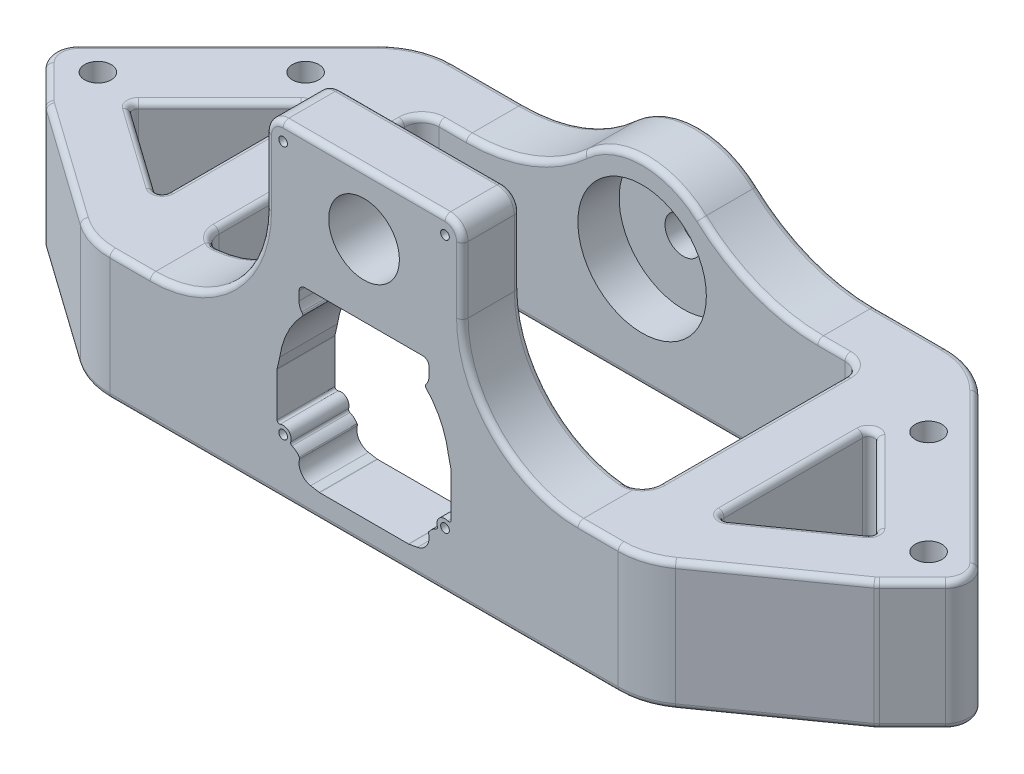
from build123d import *

# Parameters (mm, degrees)
SKETCH1_W           = 96.2
SKETCH1_H           = 58.1
SKETCH1_W_2         = 76.2
SKETCH1_H_2         = 38.1
SKETCH1_R           = 2.3
BOSS_EXTRUDE1_DEPTH = 22.25
BOSS_EXTRUDE2_START = 22.25
SKETCH1_3_W         = 96.2
SKETCH1_3_H         = 58.1
SKETCH1_3_W_2       = 76.2
SKETCH1_3_H_2       = 38.1
BOSS_EXTRUDE2_DEPTH = 15.85
SKETCH3_W           = 34
SKETCH3_H           = 18.6
SKETCH3_R           = 0.75
SKETCH3_R_2         = 6.113994518
BOSS_EXTRUDE3_DEPTH = 10
CUT_EXTRUDE1_REACH  = 116.403
SKETCH3_3_W         = 31.1
SKETCH3_3_H         = 15.85
CUT_EXTRUDE2_REACH  = 116.403
SKETCH3_4_R         = 0.75
CUT_EXTRUDE3_REACH  = 116.403
FILLET1_R           = 20
FILLET2_R           = 3
FILLET3_R           = 1
FILLET4_R           = 1
FILLET5_R           = 3
FILLET6_R           = 13
FILLET7_R           = 4
SKETCH5_R           = 11.1125
CUT_EXTRUDE4_DEPTH  = 7.1374
FILLET8_R           = 30
FILLET9_R           = 1


with BuildPart() as part:
    # Sketch1 → Boss-Extrude1 (new body)
    # profile 1 of 5: a face of its own
    with BuildSketch(Plane(origin=(0, 0, 0), x_dir=(1, 0, 0), z_dir=(0, 1, 0))):
        Rectangle(SKETCH1_W, SKETCH1_H)
        Rectangle(SKETCH1_W_2, SKETCH1_H_2, mode=Mode.SUBTRACT)
    # profile 2 of 5: a face of its own
    with BuildSketch(Plane(origin=(0, 0, 0), x_dir=(1, 0, 0), z_dir=(0, 1, 0))):
        Polygon((-80.606778943, -3.456778943), (-71.842048969, -12.221508917), (-64.669047511, -5.048507459), (-48.1, 11.520540052), (-48.1, 29.05), align=None)
        with Locations(Location((-71.842048969, -3.241252796, 0), (0, 0, 270))):
            Circle(SKETCH1_R, mode=Mode.SUBTRACT)
        with Locations(Location((-53.881536726, 14.719259446, 0), (0, 0, 270))):
            Circle(SKETCH1_R, mode=Mode.SUBTRACT)
    # profile 3 of 5: a face of its own
    with BuildSketch(Plane(origin=(0, 0, 0), x_dir=(1, 0, 0), z_dir=(0, 1, 0))):
        Polygon((64.669047511, -5.048507459), (71.842048969, -12.221508917), (80.606778943, -3.456778943), (48.1, 29.05), (48.1, 11.520540052), align=None)
        with Locations(Location((71.842048969, -3.241252796, 0), (0, 0, 270))):
            Circle(SKETCH1_R, mode=Mode.SUBTRACT)
        with Locations(Location((53.881536726, 14.719259446, 0), (0, 0, 270))):
            Circle(SKETCH1_R, mode=Mode.SUBTRACT)
    # profile 4 of 5: a face of its own
    with BuildSketch(Plane(origin=(0, 0, 0), x_dir=(1, 0, 0), z_dir=(0, 1, 0))):
        Polygon((-71.842048969, -12.221508917), (-48.1, -29.05), (-48.1, -16.792736808), (-64.669047511, -5.048507459), align=None)
    # profile 5 of 5: a face of its own
    with BuildSketch(Plane(origin=(0, 0, 0), x_dir=(1, 0, 0), z_dir=(0, 1, 0))):
        Polygon((48.1, -16.792736808), (48.1, -29.05), (71.842048969, -12.221508917), (64.669047511, -5.048507459), align=None)
    extrude(amount=BOSS_EXTRUDE1_DEPTH)

    # Sketch1<3> → Boss-Extrude2 (add)
    with BuildSketch(Plane(origin=(0, 0, 0), x_dir=(1, 0, 0), z_dir=(0, 1, 0)).offset(BOSS_EXTRUDE2_START)):
        Rectangle(SKETCH1_3_W, SKETCH1_3_H)
        Rectangle(SKETCH1_3_W_2, SKETCH1_3_H_2, mode=Mode.SUBTRACT)
    extrude(amount=BOSS_EXTRUDE2_DEPTH)

    # Sketch3 → Boss-Extrude3 (add)
    with BuildSketch(Plane.XY.offset(29.05)):
        with Locations((0, 47.4)):
            Rectangle(SKETCH3_W, SKETCH3_H)
        with Locations((-14, 53.7)):
            Circle(SKETCH3_R, mode=Mode.SUBTRACT)
        with Locations((0, 46.05)):
            Circle(SKETCH3_R_2, mode=Mode.SUBTRACT)
        with Locations((14, 53.7)):
            Circle(SKETCH3_R, mode=Mode.SUBTRACT)
    extrude(amount=-BOSS_EXTRUDE3_DEPTH)

    # Sketch3<3> → Cut-Extrude1 (cut, up to next)
    with BuildSketch(Plane.XY.offset(29.05), mode=Mode.PRIVATE) as cut_extrude1_sk1:
        with Locations((-32.55, 30.175)):
            Rectangle(SKETCH3_3_W, SKETCH3_3_H)
    cut_extrude1_tool1 = extrude(cut_extrude1_sk1.sketch, amount=-CUT_EXTRUDE1_REACH, mode=Mode.PRIVATE) & part.part
    # Sketch3<3> → Cut-Extrude1 (cut, up to next)
    with BuildSketch(Plane.XY.offset(29.05), mode=Mode.PRIVATE) as cut_extrude1_sk2:
        with Locations((32.55, 30.175)):
            Rectangle(SKETCH3_3_W, SKETCH3_3_H)
    cut_extrude1_tool2 = extrude(cut_extrude1_sk2.sketch, amount=-CUT_EXTRUDE1_REACH, mode=Mode.PRIVATE) & part.part
    add(cut_extrude1_tool1.solids().sort_by_distance((-32.55, 30.175, 29.05))[0], mode=Mode.SUBTRACT)
    add(cut_extrude1_tool2.solids().sort_by_distance((32.55, 30.175, 29.05))[0], mode=Mode.SUBTRACT)

    # Sketch3<4> → Cut-Extrude2 (cut, up to next)
    with BuildSketch(Plane.XY.offset(29.05), mode=Mode.PRIVATE) as cut_extrude2_sk1:
        with BuildLine():
            Line((-7.677283888, 4.25512505), (0, 4.25512505))
            Line((0, 4.25512505), (0, 33.677419885))
            ThreePointArc((0, 33.677419885), (-3.224781029, 33.317522554), (-6.29087514, 32.255540598))
            add(Edge.make_bspline(
                [(-6.29087514, 32.255540598), (-6.354123344, 32.225410324), (-6.425940061, 32.218415461), (-6.561336137, 32.252753207), (-6.621409073, 32.293361112), (-6.662588328, 32.350039494)],
                knots=[0, 0, 0, 0, 0.000207192, 0.000207192, 0.000414384, 0.000414384, 0.000414384, 0.000414384], degree=3))
            Line((-6.662588328, 32.350039494), (-6.852954845, 32.612056525))
            ThreePointArc((-6.852954845, 32.612056525), (-9.566892781, 33.493868415), (-11.24419867, 31.185254916))
            ThreePointArc((-11.24419867, 31.185254916), (-11.125392284, 30.435140919), (-10.780602724, 29.758453306))
            Line((-10.780602724, 29.758453306), (-10.650014249, 29.57871369))
            add(Edge.make_bspline(
                [(-10.650014249, 29.57871369), (-10.608797348, 29.521983492), (-10.588802383, 29.452580884), (-10.597914493, 29.313081434), (-10.626954198, 29.246551285), (-10.675261528, 29.195722635)],
                knots=[0, 0, 0, 0, 0.000207381, 0.000207381, 0.000414763, 0.000414763, 0.000414763, 0.000414763], degree=3))
            ThreePointArc((-10.675261528, 29.195722635), (-13.260415941, 25.457672398), (-14.582722774, 21.10939141))
            Line((-14.582722774, 21.10939141), (-15.034823926, 19.130918405))
            ThreePointArc((-15.034823926, 19.130918405), (-15.042354252, 19.086649043), (-15.04487495, 19.041814589))
            Line((-15.04487495, 19.041814589), (-15.04487495, 11.477902311))
            add(Edge.make_bspline(
                [(-15.04487495, 11.477902311), (-15.04487495, 11.347556499), (-14.977913043, 11.221268418), (-14.764315845, 11.074786106), (-14.623061319, 11.057781693), (-14.501392579, 11.104544234)],
                knots=[0, 0, 0, 0, 0.000387965, 0.000387965, 0.00077593, 0.00077593, 0.00077593, 0.00077593], degree=3))
            ThreePointArc((-14.501392579, 11.104544234), (-13.035153586, 10.811089301), (-12.67342862, 9.360183504))
            add(Edge.make_bspline(
                [(-12.67342862, 9.360183504), (-12.705194241, 9.264372263), (-12.698958784, 9.158171677), (-12.615527042, 8.976534106), (-12.53920304, 8.902740582), (-12.445843703, 8.864362493)],
                knots=[0, 0, 0, 0, 0.000301952, 0.000301952, 0.000603904, 0.000603904, 0.000603904, 0.000603904], degree=3))
            ThreePointArc((-12.445843703, 8.864362493), (-11.739786176, 8.442159607), (-11.188695899, 7.831363394))
            add(Edge.make_bspline(
                [(-11.188695899, 7.831363394), (-11.14058364, 7.758747016), (-11.126397589, 7.666819684), (-11.150380907, 7.58307766)],
                knots=[0, 0, 0, 0, 0.000257617, 0.000257617, 0.000257617, 0.000257617], degree=3))
            ThreePointArc((-11.150380907, 7.58307766), (-10.875139467, 5.628075507), (-9.238295824, 4.524203161))
            Line((-9.238295824, 4.524203161), (-7.746740514, 4.261201717))
            ThreePointArc((-7.746740514, 4.261201717), (-7.712144857, 4.256647112), (-7.677283888, 4.25512505))
        make_face()
    cut_extrude2_tool1 = extrude(cut_extrude2_sk1.sketch, amount=-CUT_EXTRUDE2_REACH, mode=Mode.PRIVATE) & part.part
    # Sketch3<4> → Cut-Extrude2 (cut, up to next)
    with BuildSketch(Plane.XY.offset(29.05), mode=Mode.PRIVATE) as cut_extrude2_sk2:
        with BuildLine():
            Line((0, 33.677419885), (0, 4.25512505))
            Line((0, 4.25512505), (7.677283888, 4.25512505))
            ThreePointArc((7.677283888, 4.25512505), (7.712144857, 4.256647112), (7.746740514, 4.261201717))
            Line((7.746740514, 4.261201717), (9.238295824, 4.524203161))
            ThreePointArc((9.238295824, 4.524203161), (10.875139467, 5.628075507), (11.150380907, 7.58307766))
            add(Edge.make_bspline(
                [(11.150380907, 7.58307766), (11.126397587, 7.666819693), (11.140583645, 7.758747024), (11.188695899, 7.831363394)],
                knots=[0, 0, 0, 0, 0.000257617, 0.000257617, 0.000257617, 0.000257617], degree=3))
            ThreePointArc((11.188695899, 7.831363394), (11.739786176, 8.442159607), (12.445843703, 8.864362493))
            add(Edge.make_bspline(
                [(12.445843703, 8.864362493), (12.539203063, 8.902740591), (12.615665227, 8.976706684), (12.698999551, 9.15838897), (12.705194234, 9.264372286), (12.67342862, 9.360183504)],
                knots=[0, 0, 0, 0, 0.000301952, 0.000301952, 0.000603904, 0.000603904, 0.000603904, 0.000603904], degree=3))
            ThreePointArc((12.67342862, 9.360183504), (13.035153586, 10.811089301), (14.501392579, 11.104544234))
            add(Edge.make_bspline(
                [(14.501392579, 11.104544234), (14.623061366, 11.057781675), (14.76496564, 11.07497916), (14.978326365, 11.221805697), (15.04487495, 11.347556549), (15.04487495, 11.477902311)],
                knots=[0, 0, 0, 0, 0.000387965, 0.000387965, 0.00077593, 0.00077593, 0.00077593, 0.00077593], degree=3))
            Line((15.04487495, 11.477902311), (15.04487495, 19.041814589))
            ThreePointArc((15.04487495, 19.041814589), (15.042354252, 19.086649043), (15.034823926, 19.130918405))
            Line((15.034823926, 19.130918405), (14.582722774, 21.10939141))
            ThreePointArc((14.582722774, 21.10939141), (13.260415941, 25.457672398), (10.675261528, 29.195722635))
            add(Edge.make_bspline(
                [(10.675261528, 29.195722635), (10.626954205, 29.246551277), (10.598021636, 29.312728517), (10.588742494, 29.452216956), (10.608797342, 29.521983484), (10.650014249, 29.57871369)],
                knots=[0, 0, 0, 0, 0.000207381, 0.000207381, 0.000414763, 0.000414763, 0.000414763, 0.000414763], degree=3))
            Line((10.650014249, 29.57871369), (10.780602724, 29.758453306))
            ThreePointArc((10.780602724, 29.758453306), (11.125392284, 30.435140919), (11.24419867, 31.185254916))
            Line((11.24419867, 31.185254916), (11.242123633, 31.28560265))
            ThreePointArc((11.242123633, 31.28560265), (9.519004074, 33.508882885), (6.852954845, 32.612056525))
            Line((6.852954845, 32.612056525), (6.662588328, 32.350039494))
            add(Edge.make_bspline(
                [(6.662588328, 32.350039494), (6.621409079, 32.293361119), (6.561652549, 32.252917009), (6.426296286, 32.218422661), (6.354123353, 32.225410319), (6.29087514, 32.255540598)],
                knots=[0, 0, 0, 0, 0.000207192, 0.000207192, 0.000414384, 0.000414384, 0.000414384, 0.000414384], degree=3))
            ThreePointArc((6.29087514, 32.255540598), (3.224781029, 33.317522554), (0, 33.677419885))
        make_face()
    cut_extrude2_tool2 = extrude(cut_extrude2_sk2.sketch, amount=-CUT_EXTRUDE2_REACH, mode=Mode.PRIVATE) & part.part
    # Sketch3<4> → Cut-Extrude2 (cut, up to next)
    with BuildSketch(Plane.XY.offset(29.05), mode=Mode.PRIVATE) as cut_extrude2_sk3:
        with BuildLine():
            ThreePointArc((-6.29087514, 32.255540598), (-3.224781029, 33.317522554), (0, 33.677419885))
            Line((0, 33.677419885), (-11.24419867, 33.677419885))
            Line((-11.24419867, 33.677419885), (-11.24419867, 31.185254916))
            ThreePointArc((-11.24419867, 31.185254916), (-9.566892781, 33.493868415), (-6.852954845, 32.612056525))
            Line((-6.852954845, 32.612056525), (-6.662588328, 32.350039494))
            add(Edge.make_bspline(
                [(-6.29087514, 32.255540598), (-6.354123344, 32.225410324), (-6.425940061, 32.218415461), (-6.561336137, 32.252753207), (-6.621409073, 32.293361112), (-6.662588328, 32.350039494)],
                knots=[0, 0, 0, 0, 0.000207192, 0.000207192, 0.000414384, 0.000414384, 0.000414384, 0.000414384], degree=3))
        make_face()
    cut_extrude2_tool3 = extrude(cut_extrude2_sk3.sketch, amount=-CUT_EXTRUDE2_REACH, mode=Mode.PRIVATE) & part.part
    # Sketch3<4> → Cut-Extrude2 (cut, up to next)
    with BuildSketch(Plane.XY.offset(29.05), mode=Mode.PRIVATE) as cut_extrude2_sk4:
        with BuildLine():
            Line((11.192664519, 33.677419885), (0, 33.677419885))
            ThreePointArc((0, 33.677419885), (3.224781029, 33.317522554), (6.29087514, 32.255540598))
            add(Edge.make_bspline(
                [(6.662588328, 32.350039494), (6.621409079, 32.293361119), (6.561652549, 32.252917009), (6.426296286, 32.218422661), (6.354123353, 32.225410319), (6.29087514, 32.255540598)],
                knots=[0, 0, 0, 0, 0.000207192, 0.000207192, 0.000414384, 0.000414384, 0.000414384, 0.000414384], degree=3))
            Line((6.662588328, 32.350039494), (6.852954845, 32.612056525))
            ThreePointArc((6.852954845, 32.612056525), (9.519004074, 33.508882885), (11.242123633, 31.28560265))
            Line((11.242123633, 31.28560265), (11.192664519, 33.677419885))
        make_face()
    cut_extrude2_tool4 = extrude(cut_extrude2_sk4.sketch, amount=-CUT_EXTRUDE2_REACH, mode=Mode.PRIVATE) & part.part
    # Sketch3<4> → Cut-Extrude2 (cut, up to next)
    with BuildSketch(Plane.XY.offset(29.05), mode=Mode.PRIVATE) as cut_extrude2_sk5:
        with Locations((14, 9.8)):
            Circle(SKETCH3_4_R)
    cut_extrude2_tool5 = extrude(cut_extrude2_sk5.sketch, amount=-CUT_EXTRUDE2_REACH, mode=Mode.PRIVATE) & part.part
    # Sketch3<4> → Cut-Extrude2 (cut, up to next)
    with BuildSketch(Plane.XY.offset(29.05), mode=Mode.PRIVATE) as cut_extrude2_sk6:
        with Locations((-14, 9.8)):
            Circle(SKETCH3_4_R)
    cut_extrude2_tool6 = extrude(cut_extrude2_sk6.sketch, amount=-CUT_EXTRUDE2_REACH, mode=Mode.PRIVATE) & part.part
    add(cut_extrude2_tool1.solids().sort_by_distance((-6.658417, 18.623439, 29.05))[0], mode=Mode.SUBTRACT)
    add(cut_extrude2_tool2.solids().sort_by_distance((6.658414, 18.623445, 29.05))[0], mode=Mode.SUBTRACT)
    add(cut_extrude2_tool3.solids().sort_by_distance((-6.742029, 33.207755, 29.05))[0], mode=Mode.SUBTRACT)
    add(cut_extrude2_tool4.solids().sort_by_distance((6.692011, 33.21179, 29.05))[0], mode=Mode.SUBTRACT)
    add(cut_extrude2_tool5.solids().sort_by_distance((14, 9.8, 29.05))[0], mode=Mode.SUBTRACT)
    add(cut_extrude2_tool6.solids().sort_by_distance((-14, 9.8, 29.05))[0], mode=Mode.SUBTRACT)

    # Sketch4 → Cut-Extrude3 (cut, up to next)
    with BuildSketch(Plane(origin=(0, 0, -29.05), x_dir=(-1, 0, 0), z_dir=(0, 0, -1)), mode=Mode.PRIVATE) as cut_extrude3_sk1:
        with BuildLine():
            Line((-17, 22.25), (-14.654692081, 22.25))
            ThreePointArc((-14.654692081, 22.25), (-9.407443861, 30.733321446), (0, 34.05))
            Line((0, 34.05), (0, 38.1))
            Line((0, 38.1), (-17, 38.1))
            Line((-17, 38.1), (-17, 22.25))
        make_face()
    cut_extrude3_tool1 = extrude(cut_extrude3_sk1.sketch, amount=-CUT_EXTRUDE3_REACH, mode=Mode.PRIVATE) & part.part
    # Sketch4 → Cut-Extrude3 (cut, up to next)
    with BuildSketch(Plane(origin=(0, 0, -29.05), x_dir=(-1, 0, 0), z_dir=(0, 0, -1)), mode=Mode.PRIVATE) as cut_extrude3_sk2:
        with BuildLine():
            Line((0, 38.1), (0, 34.05))
            ThreePointArc((0, 34.05), (9.407443861, 30.733321446), (14.654692081, 22.25))
            Line((14.654692081, 22.25), (17, 22.25))
            Line((17, 22.25), (17, 38.1))
            Line((17, 38.1), (0, 38.1))
        make_face()
    cut_extrude3_tool2 = extrude(cut_extrude3_sk2.sketch, amount=-CUT_EXTRUDE3_REACH, mode=Mode.PRIVATE) & part.part
    # Sketch4 → Cut-Extrude3 (cut, up to next)
    with BuildSketch(Plane(origin=(0, 0, -29.05), x_dir=(-1, 0, 0), z_dir=(0, 0, -1)), mode=Mode.PRIVATE) as cut_extrude3_sk3:
        with BuildLine():
            ThreePointArc((0, 22.225), (-3.175, 19.05), (0, 15.875))
            Line((0, 15.875), (0, 22.225))
        make_face()
    cut_extrude3_tool3 = extrude(cut_extrude3_sk3.sketch, amount=-CUT_EXTRUDE3_REACH, mode=Mode.PRIVATE) & part.part
    # Sketch4 → Cut-Extrude3 (cut, up to next)
    with BuildSketch(Plane(origin=(0, 0, -29.05), x_dir=(-1, 0, 0), z_dir=(0, 0, -1)), mode=Mode.PRIVATE) as cut_extrude3_sk4:
        with BuildLine():
            Line((0, 22.225), (0, 15.875))
            ThreePointArc((0, 15.875), (2.24506403, 16.80493597), (3.175, 19.05))
            ThreePointArc((3.175, 19.05), (2.24506403, 21.29506403), (0, 22.225))
        make_face()
    cut_extrude3_tool4 = extrude(cut_extrude3_sk4.sketch, amount=-CUT_EXTRUDE3_REACH, mode=Mode.PRIVATE) & part.part
    # Sketch4 → Cut-Extrude3 (cut, up to next)
    with BuildSketch(Plane(origin=(0, 0, -29.05), x_dir=(-1, 0, 0), z_dir=(0, 0, -1)), mode=Mode.PRIVATE) as cut_extrude3_sk5:
        with BuildLine():
            ThreePointArc((0, 22.225), (-3.175, 19.05), (0, 15.875))
            Line((0, 15.875), (0, 22.225))
        make_face()
    cut_extrude3_tool5 = extrude(cut_extrude3_sk5.sketch, amount=-CUT_EXTRUDE3_REACH, mode=Mode.PRIVATE) & part.part
    # Sketch4 → Cut-Extrude3 (cut, up to next)
    with BuildSketch(Plane(origin=(0, 0, -29.05), x_dir=(-1, 0, 0), z_dir=(0, 0, -1)), mode=Mode.PRIVATE) as cut_extrude3_sk6:
        with BuildLine():
            Line((0, 22.225), (0, 15.875))
            ThreePointArc((0, 15.875), (2.24506403, 16.80493597), (3.175, 19.05))
            ThreePointArc((3.175, 19.05), (2.24506403, 21.29506403), (0, 22.225))
        make_face()
    cut_extrude3_tool6 = extrude(cut_extrude3_sk6.sketch, amount=-CUT_EXTRUDE3_REACH, mode=Mode.PRIVATE) & part.part
    add(cut_extrude3_tool1.solids().sort_by_distance((10.827646, 32.931651, -29.05))[0], mode=Mode.SUBTRACT)
    add(cut_extrude3_tool2.solids().sort_by_distance((-10.827646, 32.931651, -29.05))[0], mode=Mode.SUBTRACT)
    add(cut_extrude3_tool3.solids().sort_by_distance((1.347512, 19.05, -29.05))[0], mode=Mode.SUBTRACT)
    add(cut_extrude3_tool4.solids().sort_by_distance((-1.347512, 19.05, -29.05))[0], mode=Mode.SUBTRACT)
    add(cut_extrude3_tool5.solids().sort_by_distance((1.347512, 19.05, -29.05))[0], mode=Mode.SUBTRACT)
    add(cut_extrude3_tool6.solids().sort_by_distance((-1.347512, 19.05, -29.05))[0], mode=Mode.SUBTRACT)

    # Fillet1
    fillet1_edges = [part.edges().sort_by_distance(p)[0] for p in [
        (-17, 22.25, 24.05),
        (17, 22.25, 24.05),
    ]]
    fillet(fillet1_edges, radius=FILLET1_R)

    # Fillet2
    fillet2_edges = [part.edges().sort_by_distance(p)[0] for p in [
        (17, 56.7, 24.05),
        (-17, 56.7, 24.05),
    ]]
    fillet(fillet2_edges, radius=FILLET2_R)

    # Fillet3
    fillet3_edges = [part.edges().sort_by_distance(p)[0] for p in [
        (-11.24419867, 33.677419885, 24.05),
        (11.192664519, 33.677419885, 24.05),
    ]]
    fillet(fillet3_edges, radius=FILLET3_R)

    # Fillet4
    fillet4_edges = [part.edges().sort_by_distance(p)[0] for p in [
        (-48.1, 11.125, 16.792736808),
        (-48.1, 11.125, -11.520540052),
        (-64.669047511, 11.125, 5.048507459),
        (48.1, 11.125, -11.520540052),
        (48.1, 11.125, 16.792736808),
        (64.669047511, 11.125, 5.048507459),
    ]]
    fillet(fillet4_edges, radius=FILLET4_R)

    # Fillet5
    fillet5_edges = [part.edges().sort_by_distance(p)[0] for p in [
        (-38.1, 11.125, -19.05),
        (38.1, 11.125, -19.05),
        (38.1, 11.125, 19.05),
        (-38.1, 11.125, 19.05),
    ]]
    fillet(fillet5_edges, radius=FILLET5_R)

    # Fillet6
    fillet6_edges = [part.edges().sort_by_distance(p)[0] for p in [
        (-48.1, 11.125, 29.05),
        (-48.1, 11.125, -29.05),
        (48.1, 11.125, -29.05),
        (48.1, 11.125, 29.05),
    ]]
    fillet(fillet6_edges, radius=FILLET6_R)

    # Fillet7
    fillet7_edges = [part.edges().sort_by_distance(p)[0] for p in [
        (-71.842048969, 11.125, 12.221508917),
        (-80.606778943, 11.125, 3.456778943),
        (80.606778943, 11.125, 3.456778943),
        (71.842048969, 11.125, 12.221508917),
    ]]
    fillet(fillet7_edges, radius=FILLET7_R)

    # Sketch5 → Cut-Extrude4 (cut)
    with BuildSketch(Plane.XY.offset(-19.05)):
        with Locations((0, 19.05)):
            Circle(SKETCH5_R)
    extrude(amount=-CUT_EXTRUDE4_DEPTH, mode=Mode.SUBTRACT)

    # Fillet8
    fillet8_edges = [part.edges().sort_by_distance(p)[0] for p in [
        (-14.654692081, 22.25, -24.05),
        (14.654692081, 22.25, -24.05),
    ]]
    fillet(fillet8_edges, radius=FILLET8_R)

    # Fillet9
    fillet9_edges = [part.edges().sort_by_distance(p)[0] for p in [
        (40.480008435, 22.25, 29.05),
        (17, 47.975, 19.05),
        (-17, 47.975, 29.05),
        (22.857864376, 28.107864376, 29.05),
        (22.201351413, 28.796375953, 19.05),
        (-22.857864376, 28.107864376, 29.05),
        (0, 56.7, 19.05),
        (0, 56.7, 29.05),
        (17, 47.975, 29.05),
        (16.121320344, 55.821320344, 29.05),
        (-16.121320344, 55.821320344, 29.05),
        (-17, 47.975, 19.05),
        (16.121320344, 55.821320344, 19.05),
        (-16.121320344, 55.821320344, 19.05),
        (48.1, 22.25, 2.87593933),
        (48.1, 0, 2.87593933),
        (56.690345587, 0, 10.703853986),
        (56.690345587, 22.25, 10.703853986),
        (56.819178631, 0, -2.80136142),
        (56.819178631, 22.25, -2.80136142),
        (-56.690345587, 0, 10.703853986),
        (-56.690345587, 22.25, 10.703853986),
        (-48.1, 22.25, 2.87593933),
        (-48.1, 0, 2.87593933),
        (-56.819178631, 0, -2.80136142),
        (-56.819178631, 22.25, -2.80136142),
        (48.640801643, 0, 15.746538909),
        (48.640801643, 22.25, 15.746538909),
        (64.120584682, 0, 5.002110562),
        (64.120584682, 22.25, 5.002110562),
        (-48.640801643, 0, 15.746538909),
        (-48.640801643, 22.25, 15.746538909),
        (-64.120584682, 0, 5.002110562),
        (-64.120584682, 22.25, 5.002110562),
        (48.717316568, 0, -10.030206022),
        (48.717316568, 22.25, -10.030206022),
        (-48.717316568, 0, -10.030206022),
        (-48.717316568, 22.25, -10.030206022),
        (32.738482479, 22.25, -19.05),
        (0, 0, -19.05),
        (-38.1, 22.25, 0),
        (-38.1, 0, 0),
        (38.1, 22.25, 0),
        (38.1, 0, 0),
        (0, 0, 19.05),
        (-22.201351413, 28.796375953, 19.05),
        (-37.221320344, 0, -18.171320344),
        (-37.221320344, 22.25, -18.171320344),
        (37.221320344, 0, -18.171320344),
        (37.221320344, 22.25, -18.171320344),
        (37.221320344, 0, 18.171320344),
        (37.811088342, 22.25, 17.334523258),
        (36.10766428, 22.269916498, 18.875705742),
        (-37.221320344, 0, 18.171320344),
        (-36.10766428, 22.269916498, 18.875705742),
        (-37.811088342, 22.25, 17.334523258),
        (36.546094323, 22.25, -29.05),
        (0, 0, -29.05),
        (0, 0, 29.05),
        (-61.521780707, 0, 19.536570167),
        (-64.842981831, 0, -12.307018169),
        (64.842981831, 0, -12.307018169),
        (61.521780707, 0, 19.536570167),
        (47.90479606, 0, 28.437038271),
        (-47.90479606, 0, 28.437038271),
        (-47.69010831, 0, -28.060433923),
        (47.69010831, 0, -28.060433923),
        (64.842981831, 22.25, -12.307018169),
        (61.521780707, 22.25, 19.536570167),
        (47.90479606, 22.25, 28.437038271),
        (47.69010831, 22.25, -28.060433923),
        (-64.842981831, 22.25, -12.307018169),
        (-40.480008435, 22.25, 29.05),
        (-61.521780707, 22.25, 19.536570167),
        (-47.90479606, 22.25, 28.437038271),
        (-47.69010831, 22.25, -28.060433923),
        (74.929834976, 0, 9.13372291),
        (-74.929834976, 0, 9.13372291),
        (-71.832834109, 0, 12.210590931),
        (71.832834109, 0, 12.210590931),
        (-78.949924693, 0, 3.456778943),
        (78.949924693, 0, 3.456778943),
        (74.929834976, 22.25, 9.13372291),
        (71.832834109, 22.25, 12.210590931),
        (78.949924693, 22.25, 3.456778943),
        (-74.929834976, 22.25, 9.13372291),
        (-71.832834109, 22.25, 12.210590931),
        (-78.949924693, 22.25, 3.456778943),
        (0, 34.05, -19.05),
        (0, 34.05, -29.05),
        (-32.738482479, 22.25, -19.05),
        (-36.546094323, 22.25, -29.05),
        (19.514184466, 24.285737092, -29.05),
        (19.514184466, 24.285737092, -19.05),
        (-19.514184466, 24.285737092, -29.05),
        (-19.514184466, 24.285737092, -19.05),
    ]]
    fillet(fillet9_edges, radius=FILLET9_R)


solid = part.part
